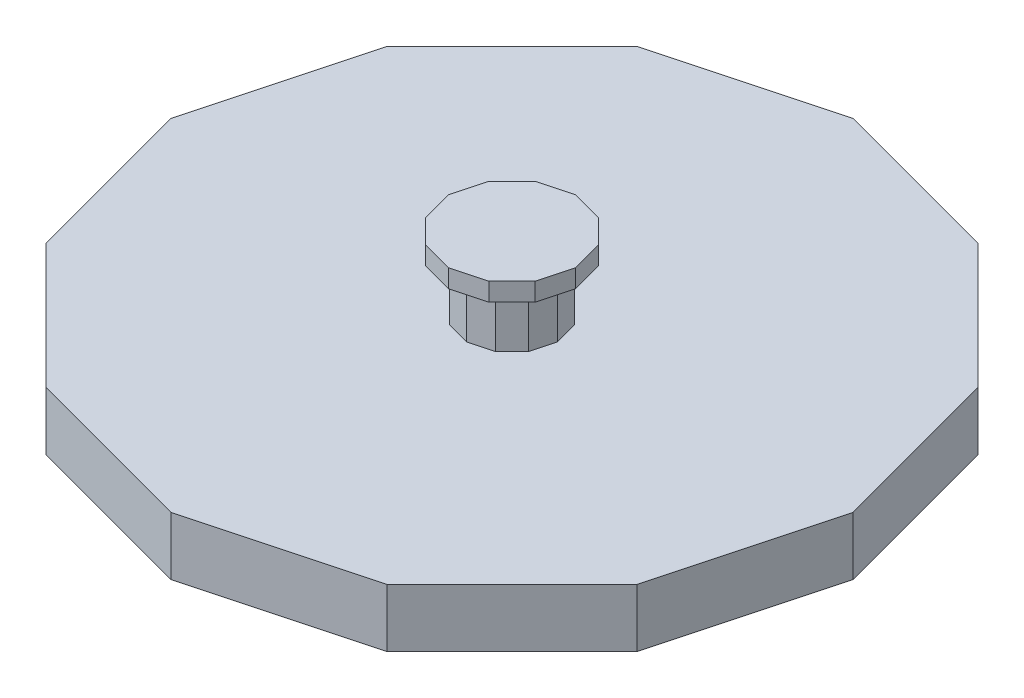
from build123d import *

# Parameters (mm, degrees)
BOSS_EXTRUDE1_DEPTH = 2
BOSS_EXTRUDE2_DEPTH = 30
BOSS_EXTRUDE3_DEPTH = 30
BOSS_EXTRUDE4_DEPTH = 30
BOSS_EXTRUDE5_DEPTH = 10


with BuildPart() as part:
    # Sketch1 → Boss-Extrude1 (new body)
    with BuildSketch(Plane(origin=(0, 0, 0), x_dir=(1, 0, 0), z_dir=(0, 1, 0))):
        Polygon((0, 187.3896103), (-93.69480515, 162.284162925), (-162.284162925, 93.69480515), (-187.3896103, 0), (-162.284162925, -93.69480515), (-93.69480515, -162.284162925), (0, -187.3896103), (93.69480515, -162.284162925), (162.284162925, -93.69480515), (187.3896103, 0), (162.284162925, 93.69480515), (93.69480515, 162.284162925), align=None)
    extrude(amount=BOSS_EXTRUDE1_DEPTH)

    # Sketch2 → Boss-Extrude2 (add)
    with BuildSketch(Plane.XZ):
        Polygon((0, 187.3896103), (-93.69480515, 162.284162925), (-162.284162925, 93.69480515), (-187.3896103, 0), (-162.284162925, -93.69480515), (-93.69480515, -162.284162925), (0, -187.3896103), (93.69480515, -162.284162925), (162.284162925, -93.69480515), (187.3896103, 0), (162.284162925, 93.69480515), (93.69480515, 162.284162925), align=None)
        Polygon((0, 185.319057939), (-92.65952897, 160.491011981), (-160.491011981, 92.65952897), (-185.319057939, 0), (-160.491011981, -92.65952897), (-92.65952897, -160.491011981), (0, -185.319057939), (92.65952897, -160.491011981), (160.491011981, -92.65952897), (185.319057939, 0), (160.491011981, 92.65952897), (92.65952897, 160.491011981), align=None, mode=Mode.SUBTRACT)
    extrude(amount=BOSS_EXTRUDE2_DEPTH)

    # Sketch3 → Boss-Extrude3 (add)
    with BuildSketch(Plane(origin=(0, 2, 0), x_dir=(1, 0, 0), z_dir=(0, 1, 0))):
        Polygon((0, 25.114071484), (-12.557035742, 21.749423897), (-21.749423897, 12.557035742), (-25.114071484, 0), (-21.749423897, -12.557035742), (-12.557035742, -21.749423897), (0, -25.114071484), (12.557035742, -21.749423897), (21.749423897, -12.557035742), (25.114071484, 0), (21.749423897, 12.557035742), (12.557035742, 21.749423897), align=None)
        Polygon((0, 23.043519123), (-11.521759561, 19.956272953), (-19.956272953, 11.521759561), (-23.043519123, 0), (-19.956272953, -11.521759561), (-11.521759561, -19.956272953), (0, -23.043519123), (11.521759561, -19.956272953), (19.956272953, -11.521759561), (23.043519123, 0), (19.956272953, 11.521759561), (11.521759561, 19.956272953), align=None, mode=Mode.SUBTRACT)
    extrude(amount=BOSS_EXTRUDE3_DEPTH)

    # Sketch3<2> → Boss-Extrude4 (add)
    with BuildSketch(Plane(origin=(0, 2, 0), x_dir=(1, 0, 0), z_dir=(0, 1, 0))):
        Polygon((0, 25.114071484), (-12.557035742, 21.749423897), (-21.749423897, 12.557035742), (-25.114071484, 0), (-21.749423897, -12.557035742), (-12.557035742, -21.749423897), (0, -25.114071484), (12.557035742, -21.749423897), (21.749423897, -12.557035742), (25.114071484, 0), (21.749423897, 12.557035742), (12.557035742, 21.749423897), align=None)
        Polygon((0, 23.043519123), (-11.521759561, 19.956272953), (-19.956272953, 11.521759561), (-23.043519123, 0), (-19.956272953, -11.521759561), (-11.521759561, -19.956272953), (0, -23.043519123), (11.521759561, -19.956272953), (19.956272953, -11.521759561), (23.043519123, 0), (19.956272953, 11.521759561), (11.521759561, 19.956272953), align=None, mode=Mode.SUBTRACT)
    extrude(amount=BOSS_EXTRUDE4_DEPTH)

    # Sketch5 → Boss-Extrude5 (add)
    with BuildSketch(Plane(origin=(0, 32, 0), x_dir=(1, 0, 0), z_dir=(0, 1, 0))):
        Polygon((0, 34.773329746), (-17.386664873, 30.114586935), (-30.114586935, 17.386664873), (-34.773329746, 0), (-30.114586935, -17.386664873), (-17.386664873, -30.114586935), (0, -34.773329746), (17.386664873, -30.114586935), (30.114586935, -17.386664873), (34.773329746, 0), (30.114586935, 17.386664873), (17.386664873, 30.114586935), align=None)
    extrude(amount=BOSS_EXTRUDE5_DEPTH)


solid = part.part
